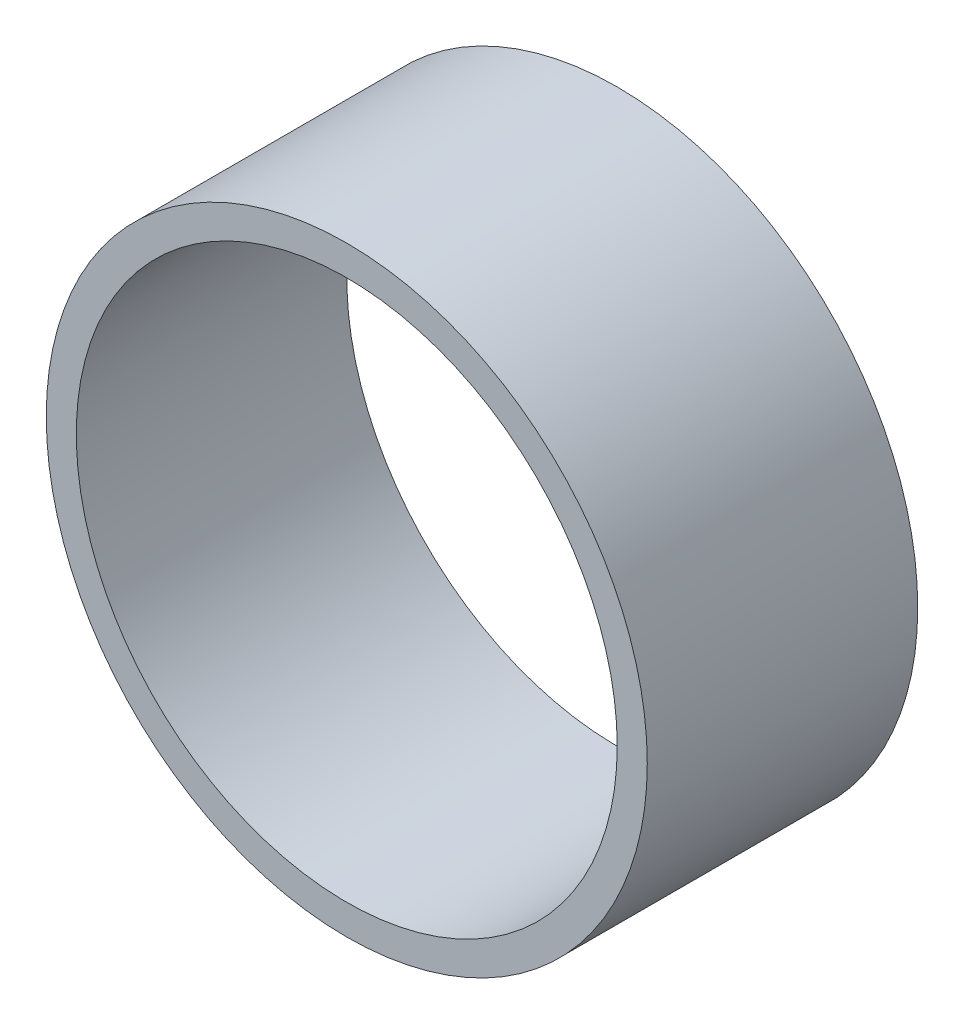
from build123d import *

# Parameters (mm, degrees)
SKETCH1_R           = 10
BOSS_EXTRUDE1_DEPTH = 9
SKETCH2_R           = 9
CUT_EXTRUDE1_DEPTH  = 9


with BuildPart() as part:
    # Sketch1 → Boss-Extrude1 (new body)
    with BuildSketch(Plane.XY):
        Circle(SKETCH1_R)
    extrude(amount=BOSS_EXTRUDE1_DEPTH)

    # Sketch2 → Cut-Extrude1 (cut)
    with BuildSketch(Plane.XY.offset(9)):
        Circle(SKETCH2_R)
    extrude(amount=-CUT_EXTRUDE1_DEPTH, mode=Mode.SUBTRACT)


solid = part.part
